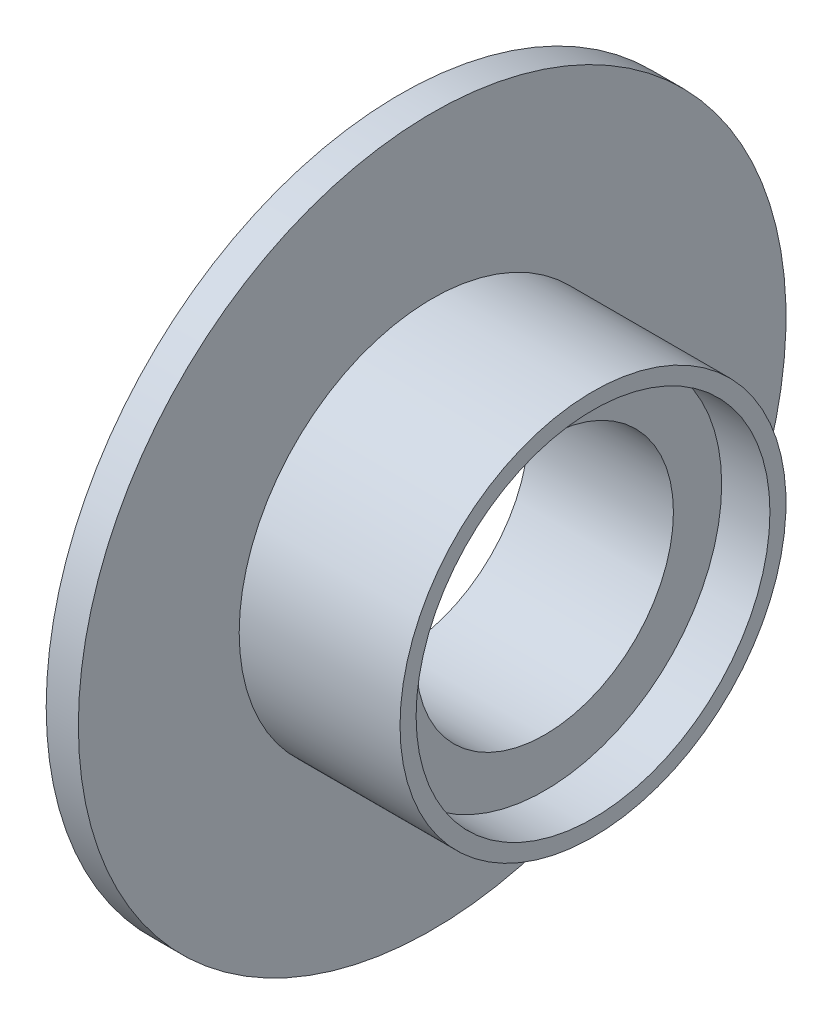
from build123d import *


with BuildPart() as part:
    # Sketch1 → Revolve1 (revolve)
    with BuildSketch(Plane(origin=(0, 0, 0), x_dir=(1, 0, 0), z_dir=(0, 1, 0)), mode=Mode.PRIVATE) as revolve1_sk:
        Polygon((0, 8), (0, 22), (2, 22), (2, 12), (12, 12), (12, 11), (9, 11), (9, 8), align=None)
    revolve(revolve1_sk.sketch.rotate(Axis((0, 0, 0), (1, 0, 0)), 180), axis=Axis((0, 0, 0), (1, 0, 0)))


solid = part.part
